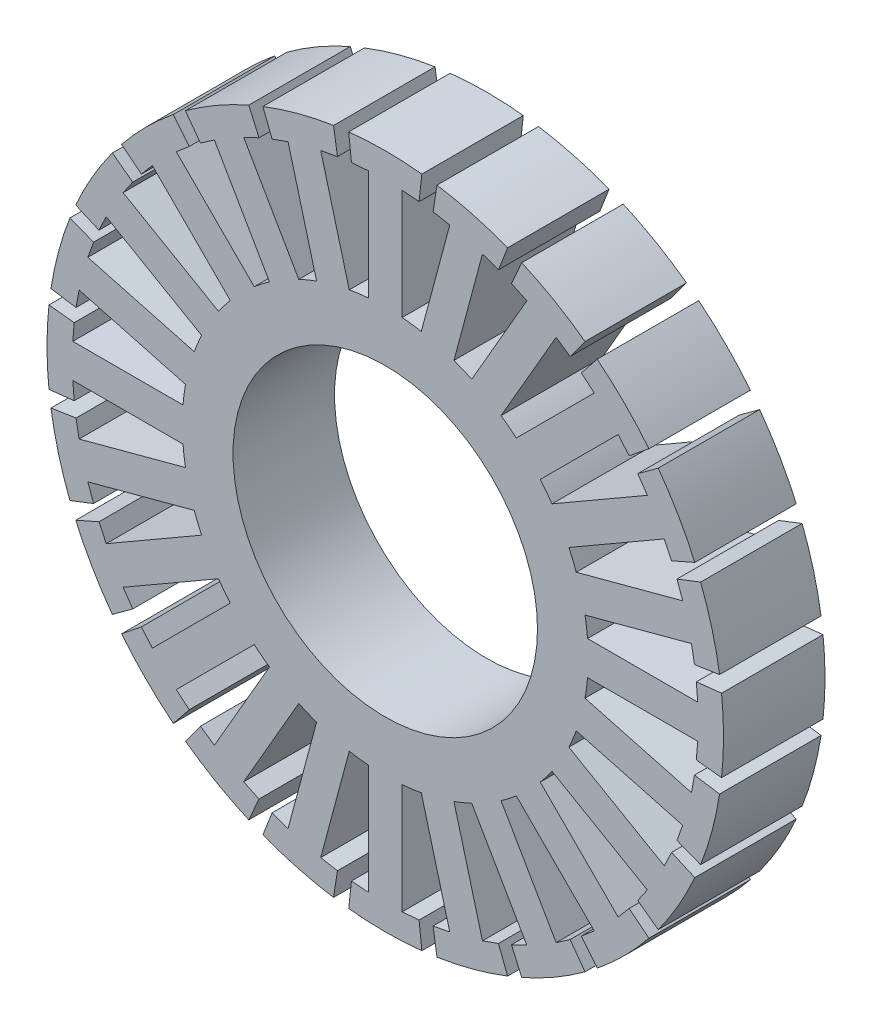
from build123d import *

# Parameters (mm, degrees)
SKETCH1_R           = 12
SKETCH1_R_2         = 9
BOSS_EXTRUDE1_DEPTH = 6


with BuildPart() as part:
    # Sketch1 → Boss-Extrude1 (new body)
    # profile 1 of 25: a face of its own
    with BuildSketch(Plane.XY):
        Circle(SKETCH1_R)
        Circle(SKETCH1_R_2, mode=Mode.SUBTRACT)
    # profile 2 of 25: a face of its own
    with BuildSketch(Plane.XY):
        with BuildLine():
            ThreePointArc((-10.856157589, 5.113104968), (-10.392304845, 6), (-9.856157589, 6.845155775))
            Line((-9.856157589, 6.845155775), (-15.498046756, 10.102502005))
            Line((-15.498046756, 10.102502005), (-14.927570436, 10.927837886))
            Line((-14.927570436, 10.927837886), (-16.137913985, 11.813878796))
            ThreePointArc((-16.137913985, 11.813878796), (-17.320508076, 10), (-18.300076147, 8.068904077))
            Line((-18.300076147, 8.068904077), (-16.927570436, 7.463736271))
            Line((-16.927570436, 7.463736271), (-16.498046756, 8.370451197))
            Line((-16.498046756, 8.370451197), (-10.856157589, 5.113104968))
        make_face()
    # profile 3 of 25: a face of its own
    with BuildSketch(Plane.XY):
        with BuildLine():
            ThreePointArc((-11.809611934, 2.1290998), (-11.591109915, 3.105828541), (-11.291973844, 4.060951453))
            Line((-11.291973844, 4.060951453), (-17.58468354, 5.747077934))
            Line((-17.58468354, 5.747077934), (-17.247258375, 6.691941314))
            Line((-17.247258375, 6.691941314), (-18.64568473, 7.23453115))
            ThreePointArc((-18.64568473, 7.23453115), (-19.318516526, 5.176380902), (-19.764902222, 3.057554604))
            Line((-19.764902222, 3.057554604), (-18.282534555, 2.828238009))
            Line((-18.282534555, 2.828238009), (-18.102321631, 3.815226282))
            Line((-18.102321631, 3.815226282), (-11.809611934, 2.1290998))
        make_face()
    # profile 4 of 25: a face of its own
    with BuildSketch(Plane.XY):
        with BuildLine():
            ThreePointArc((-11.958260743, -1), (-12, 0), (-11.958260743, 1))
            Line((-11.958260743, 1), (-18.472953202, 1))
            Line((-18.472953202, 1), (-18.391574158, 2))
            Line((-18.391574158, 2), (-19.882782873, 2.162162162))
            ThreePointArc((-19.882782873, 2.162162162), (-20, 0), (-19.882782873, -2.162162162))
            Line((-19.882782873, -2.162162162), (-18.391574158, -2))
            Line((-18.391574158, -2), (-18.472953202, -1))
            Line((-18.472953202, -1), (-11.958260743, -1))
        make_face()
    # profile 5 of 25: a face of its own
    with BuildSketch(Plane.XY):
        with BuildLine():
            ThreePointArc((-11.291973844, -4.060951453), (-11.591109915, -3.105828541), (-11.809611934, -2.1290998))
            Line((-11.809611934, -2.1290998), (-18.102321631, -3.815226282))
            Line((-18.102321631, -3.815226282), (-18.282534555, -2.828238009))
            Line((-18.282534555, -2.828238009), (-19.764902222, -3.057554604))
            ThreePointArc((-19.764902222, -3.057554604), (-19.318516526, -5.176380902), (-18.64568473, -7.23453115))
            Line((-18.64568473, -7.23453115), (-17.247258375, -6.691941314))
            Line((-17.247258375, -6.691941314), (-17.58468354, -5.747077934))
            Line((-17.58468354, -5.747077934), (-11.291973844, -4.060951453))
        make_face()
    # profile 6 of 25: a face of its own
    with BuildSketch(Plane.XY):
        with BuildLine():
            ThreePointArc((-9.856157589, -6.845155775), (-10.392304845, -6), (-10.856157589, -5.113104968))
            Line((-10.856157589, -5.113104968), (-16.498046756, -8.370451197))
            Line((-16.498046756, -8.370451197), (-16.927570436, -7.463736271))
            Line((-16.927570436, -7.463736271), (-18.300076147, -8.068904077))
            ThreePointArc((-18.300076147, -8.068904077), (-17.320508076, -10), (-16.137913985, -11.813878796))
            Line((-16.137913985, -11.813878796), (-14.927570436, -10.927837886))
            Line((-14.927570436, -10.927837886), (-15.498046756, -10.102502005))
            Line((-15.498046756, -10.102502005), (-9.856157589, -6.845155775))
        make_face()
    # profile 7 of 25: a face of its own
    with BuildSketch(Plane.XY):
        with BuildLine():
            ThreePointArc((-7.748660481, -9.162874044), (-8.485281374, -8.485281374), (-9.162874044, -7.748660481))
            Line((-9.162874044, -7.748660481), (-13.769457259, -12.355243696))
            Line((-13.769457259, -12.355243696), (-14.419020366, -11.590593241))
            Line((-14.419020366, -11.590593241), (-15.588130125, -12.530371072))
            ThreePointArc((-15.588130125, -12.530371072), (-14.142135624, -14.142135624), (-12.530371072, -15.588130125))
            Line((-12.530371072, -15.588130125), (-11.590593241, -14.419020366))
            Line((-11.590593241, -14.419020366), (-12.355243696, -13.769457259))
            Line((-12.355243696, -13.769457259), (-7.748660481, -9.162874044))
        make_face()
    # profile 8 of 25: a face of its own
    with BuildSketch(Plane.XY):
        with BuildLine():
            ThreePointArc((-5.113104968, -10.856157589), (-6, -10.392304845), (-6.845155775, -9.856157589))
            Line((-6.845155775, -9.856157589), (-10.102502005, -15.498046756))
            Line((-10.102502005, -15.498046756), (-10.927837886, -14.927570436))
            Line((-10.927837886, -14.927570436), (-11.813878796, -16.137913985))
            ThreePointArc((-11.813878796, -16.137913985), (-10, -17.320508076), (-8.068904077, -18.300076147))
            Line((-8.068904077, -18.300076147), (-7.463736271, -16.927570436))
            Line((-7.463736271, -16.927570436), (-8.370451197, -16.498046756))
            Line((-8.370451197, -16.498046756), (-5.113104968, -10.856157589))
        make_face()
    # profile 9 of 25: a face of its own
    with BuildSketch(Plane.XY):
        with BuildLine():
            ThreePointArc((-2.1290998, -11.809611934), (-3.105828541, -11.591109915), (-4.060951453, -11.291973844))
            Line((-4.060951453, -11.291973844), (-5.747077934, -17.58468354))
            Line((-5.747077934, -17.58468354), (-6.691941314, -17.247258375))
            Line((-6.691941314, -17.247258375), (-7.23453115, -18.64568473))
            ThreePointArc((-7.23453115, -18.64568473), (-5.176380902, -19.318516526), (-3.057554604, -19.764902222))
            Line((-3.057554604, -19.764902222), (-2.828238009, -18.282534555))
            Line((-2.828238009, -18.282534555), (-3.815226282, -18.102321631))
            Line((-3.815226282, -18.102321631), (-2.1290998, -11.809611934))
        make_face()
    # profile 10 of 25: a face of its own
    with BuildSketch(Plane.XY):
        with BuildLine():
            ThreePointArc((1, -11.958260743), (0, -12), (-1, -11.958260743))
            Line((-1, -11.958260743), (-1, -18.472953202))
            Line((-1, -18.472953202), (-2, -18.391574158))
            Line((-2, -18.391574158), (-2.162162162, -19.882782873))
            ThreePointArc((-2.162162162, -19.882782873), (0, -20), (2.162162162, -19.882782873))
            Line((2.162162162, -19.882782873), (2, -18.391574158))
            Line((2, -18.391574158), (1, -18.472953202))
            Line((1, -18.472953202), (1, -11.958260743))
        make_face()
    # profile 11 of 25: a face of its own
    with BuildSketch(Plane.XY):
        with BuildLine():
            Line((5.747077934, -17.58468354), (4.060951453, -11.291973844))
            ThreePointArc((4.060951453, -11.291973844), (3.105828541, -11.591109915), (2.1290998, -11.809611934))
            Line((2.1290998, -11.809611934), (3.815226282, -18.102321631))
            Line((3.815226282, -18.102321631), (2.828238009, -18.282534555))
            Line((2.828238009, -18.282534555), (3.057554604, -19.764902222))
            ThreePointArc((3.057554604, -19.764902222), (5.176380902, -19.318516526), (7.23453115, -18.64568473))
            Line((7.23453115, -18.64568473), (6.691941314, -17.247258375))
            Line((6.691941314, -17.247258375), (5.747077934, -17.58468354))
        make_face()
    # profile 12 of 25: a face of its own
    with BuildSketch(Plane.XY):
        with BuildLine():
            Line((10.102502005, -15.498046756), (6.845155775, -9.856157589))
            ThreePointArc((6.845155775, -9.856157589), (6, -10.392304845), (5.113104968, -10.856157589))
            Line((5.113104968, -10.856157589), (8.370451197, -16.498046756))
            Line((8.370451197, -16.498046756), (7.463736271, -16.927570436))
            Line((7.463736271, -16.927570436), (8.068904077, -18.300076147))
            ThreePointArc((8.068904077, -18.300076147), (10, -17.320508076), (11.813878796, -16.137913985))
            Line((11.813878796, -16.137913985), (10.927837886, -14.927570436))
            Line((10.927837886, -14.927570436), (10.102502005, -15.498046756))
        make_face()
    # profile 13 of 25: a face of its own
    with BuildSketch(Plane.XY):
        with BuildLine():
            Line((13.769457259, -12.355243696), (9.162874044, -7.748660481))
            ThreePointArc((9.162874044, -7.748660481), (8.485281374, -8.485281374), (7.748660481, -9.162874044))
            Line((7.748660481, -9.162874044), (12.355243696, -13.769457259))
            Line((12.355243696, -13.769457259), (11.590593241, -14.419020366))
            Line((11.590593241, -14.419020366), (12.530371072, -15.588130125))
            ThreePointArc((12.530371072, -15.588130125), (14.142135624, -14.142135624), (15.588130125, -12.530371072))
            Line((15.588130125, -12.530371072), (14.419020366, -11.590593241))
            Line((14.419020366, -11.590593241), (13.769457259, -12.355243696))
        make_face()
    # profile 14 of 25: a face of its own
    with BuildSketch(Plane.XY):
        with BuildLine():
            Line((16.498046756, -8.370451197), (10.856157589, -5.113104968))
            ThreePointArc((10.856157589, -5.113104968), (10.392304845, -6), (9.856157589, -6.845155775))
            Line((9.856157589, -6.845155775), (15.498046756, -10.102502005))
            Line((15.498046756, -10.102502005), (14.927570436, -10.927837886))
            Line((14.927570436, -10.927837886), (16.137913985, -11.813878796))
            ThreePointArc((16.137913985, -11.813878796), (17.320508076, -10), (18.300076147, -8.068904077))
            Line((18.300076147, -8.068904077), (16.927570436, -7.463736271))
            Line((16.927570436, -7.463736271), (16.498046756, -8.370451197))
        make_face()
    # profile 15 of 25: a face of its own
    with BuildSketch(Plane.XY):
        with BuildLine():
            Line((18.102321631, -3.815226282), (11.809611934, -2.1290998))
            ThreePointArc((11.809611934, -2.1290998), (11.591109915, -3.105828541), (11.291973844, -4.060951453))
            Line((11.291973844, -4.060951453), (17.58468354, -5.747077934))
            Line((17.58468354, -5.747077934), (17.247258375, -6.691941314))
            Line((17.247258375, -6.691941314), (18.64568473, -7.23453115))
            ThreePointArc((18.64568473, -7.23453115), (19.318516526, -5.176380902), (19.764902222, -3.057554604))
            Line((19.764902222, -3.057554604), (18.282534555, -2.828238009))
            Line((18.282534555, -2.828238009), (18.102321631, -3.815226282))
        make_face()
    # profile 16 of 25: a face of its own
    with BuildSketch(Plane.XY):
        with BuildLine():
            Line((18.472953202, 1), (11.958260743, 1))
            ThreePointArc((11.958260743, 1), (11.989560645, 0.500435352), (12, 0))
            ThreePointArc((12, 0), (11.989560645, -0.500435352), (11.958260743, -1))
            Line((11.958260743, -1), (18.472953202, -1))
            Line((18.472953202, -1), (18.391574158, -2))
            Line((18.391574158, -2), (19.882782873, -2.162162162))
            ThreePointArc((19.882782873, -2.162162162), (19.970674218, -1.082668586), (20, 0))
            ThreePointArc((20, 0), (19.970674218, 1.082668586), (19.882782873, 2.162162162))
            Line((19.882782873, 2.162162162), (18.391574158, 2))
            Line((18.391574158, 2), (18.472953202, 1))
        make_face()
    # profile 17 of 25: a face of its own
    with BuildSketch(Plane.XY):
        with BuildLine():
            Line((17.58468354, 5.747077934), (11.291973844, 4.060951453))
            ThreePointArc((11.291973844, 4.060951453), (11.591109915, 3.105828541), (11.809611934, 2.1290998))
            Line((11.809611934, 2.1290998), (18.102321631, 3.815226282))
            Line((18.102321631, 3.815226282), (18.282534555, 2.828238009))
            Line((18.282534555, 2.828238009), (19.764902222, 3.057554604))
            ThreePointArc((19.764902222, 3.057554604), (19.318516526, 5.176380902), (18.64568473, 7.23453115))
            Line((18.64568473, 7.23453115), (17.247258375, 6.691941314))
            Line((17.247258375, 6.691941314), (17.58468354, 5.747077934))
        make_face()
    # profile 18 of 25: a face of its own
    with BuildSketch(Plane.XY):
        with BuildLine():
            Line((15.498046756, 10.102502005), (9.856157589, 6.845155775))
            ThreePointArc((9.856157589, 6.845155775), (10.392304845, 6), (10.856157589, 5.113104968))
            Line((10.856157589, 5.113104968), (16.498046756, 8.370451197))
            Line((16.498046756, 8.370451197), (16.927570436, 7.463736271))
            Line((16.927570436, 7.463736271), (18.300076147, 8.068904077))
            ThreePointArc((18.300076147, 8.068904077), (17.320508076, 10), (16.137913985, 11.813878796))
            Line((16.137913985, 11.813878796), (14.927570436, 10.927837886))
            Line((14.927570436, 10.927837886), (15.498046756, 10.102502005))
        make_face()
    # profile 19 of 25: a face of its own
    with BuildSketch(Plane.XY):
        with BuildLine():
            Line((12.355243696, 13.769457259), (7.748660481, 9.162874044))
            ThreePointArc((7.748660481, 9.162874044), (8.485281374, 8.485281374), (9.162874044, 7.748660481))
            Line((9.162874044, 7.748660481), (13.769457259, 12.355243696))
            Line((13.769457259, 12.355243696), (14.419020366, 11.590593241))
            Line((14.419020366, 11.590593241), (15.588130125, 12.530371072))
            ThreePointArc((15.588130125, 12.530371072), (14.142135624, 14.142135624), (12.530371072, 15.588130125))
            Line((12.530371072, 15.588130125), (11.590593241, 14.419020366))
            Line((11.590593241, 14.419020366), (12.355243696, 13.769457259))
        make_face()
    # profile 20 of 25: a face of its own
    with BuildSketch(Plane.XY):
        with BuildLine():
            Line((8.370451197, 16.498046756), (5.113104968, 10.856157589))
            ThreePointArc((5.113104968, 10.856157589), (6, 10.392304845), (6.845155775, 9.856157589))
            Line((6.845155775, 9.856157589), (10.102502005, 15.498046756))
            Line((10.102502005, 15.498046756), (10.927837886, 14.927570436))
            Line((10.927837886, 14.927570436), (11.813878796, 16.137913985))
            ThreePointArc((11.813878796, 16.137913985), (10, 17.320508076), (8.068904077, 18.300076147))
            Line((8.068904077, 18.300076147), (7.463736271, 16.927570436))
            Line((7.463736271, 16.927570436), (8.370451197, 16.498046756))
        make_face()
    # profile 21 of 25: a face of its own
    with BuildSketch(Plane.XY):
        with BuildLine():
            Line((3.815226282, 18.102321631), (2.1290998, 11.809611934))
            ThreePointArc((2.1290998, 11.809611934), (3.105828541, 11.591109915), (4.060951453, 11.291973844))
            Line((4.060951453, 11.291973844), (5.747077934, 17.58468354))
            Line((5.747077934, 17.58468354), (6.691941314, 17.247258375))
            Line((6.691941314, 17.247258375), (7.23453115, 18.64568473))
            ThreePointArc((7.23453115, 18.64568473), (5.176380902, 19.318516526), (3.057554604, 19.764902222))
            Line((3.057554604, 19.764902222), (2.828238009, 18.282534555))
            Line((2.828238009, 18.282534555), (3.815226282, 18.102321631))
        make_face()
    # profile 22 of 25: a face of its own
    with BuildSketch(Plane.XY):
        with BuildLine():
            Line((-1, 18.472953202), (-1, 11.958260743))
            ThreePointArc((-1, 11.958260743), (0, 12), (1, 11.958260743))
            Line((1, 11.958260743), (1, 18.472953202))
            Line((1, 18.472953202), (2, 18.391574158))
            Line((2, 18.391574158), (2.162162162, 19.882782873))
            ThreePointArc((2.162162162, 19.882782873), (0, 20), (-2.162162162, 19.882782873))
            Line((-2.162162162, 19.882782873), (-2, 18.391574158))
            Line((-2, 18.391574158), (-1, 18.472953202))
        make_face()
    # profile 23 of 25: a face of its own
    with BuildSketch(Plane.XY):
        with BuildLine():
            ThreePointArc((-4.060951453, 11.291973844), (-3.105828541, 11.591109915), (-2.1290998, 11.809611934))
            Line((-2.1290998, 11.809611934), (-3.815226282, 18.102321631))
            Line((-3.815226282, 18.102321631), (-2.828238009, 18.282534555))
            Line((-2.828238009, 18.282534555), (-3.057554604, 19.764902222))
            ThreePointArc((-3.057554604, 19.764902222), (-5.176380902, 19.318516526), (-7.23453115, 18.64568473))
            Line((-7.23453115, 18.64568473), (-6.691941314, 17.247258375))
            Line((-6.691941314, 17.247258375), (-5.747077934, 17.58468354))
            Line((-5.747077934, 17.58468354), (-4.060951453, 11.291973844))
        make_face()
    # profile 24 of 25: a face of its own
    with BuildSketch(Plane.XY):
        with BuildLine():
            ThreePointArc((-6.845155775, 9.856157589), (-6, 10.392304845), (-5.113104968, 10.856157589))
            Line((-5.113104968, 10.856157589), (-8.370451197, 16.498046756))
            Line((-8.370451197, 16.498046756), (-7.463736271, 16.927570436))
            Line((-7.463736271, 16.927570436), (-8.068904077, 18.300076147))
            ThreePointArc((-8.068904077, 18.300076147), (-10, 17.320508076), (-11.813878796, 16.137913985))
            Line((-11.813878796, 16.137913985), (-10.927837886, 14.927570436))
            Line((-10.927837886, 14.927570436), (-10.102502005, 15.498046756))
            Line((-10.102502005, 15.498046756), (-6.845155775, 9.856157589))
        make_face()
    # profile 25 of 25: a face of its own
    with BuildSketch(Plane.XY):
        with BuildLine():
            ThreePointArc((-9.162874044, 7.748660481), (-8.485281374, 8.485281374), (-7.748660481, 9.162874044))
            Line((-7.748660481, 9.162874044), (-12.355243696, 13.769457259))
            Line((-12.355243696, 13.769457259), (-11.590593241, 14.419020366))
            Line((-11.590593241, 14.419020366), (-12.530371072, 15.588130125))
            ThreePointArc((-12.530371072, 15.588130125), (-14.142135624, 14.142135624), (-15.588130125, 12.530371072))
            Line((-15.588130125, 12.530371072), (-14.419020366, 11.590593241))
            Line((-14.419020366, 11.590593241), (-13.769457259, 12.355243696))
            Line((-13.769457259, 12.355243696), (-9.162874044, 7.748660481))
        make_face()
    extrude(amount=BOSS_EXTRUDE1_DEPTH)


solid = part.part
